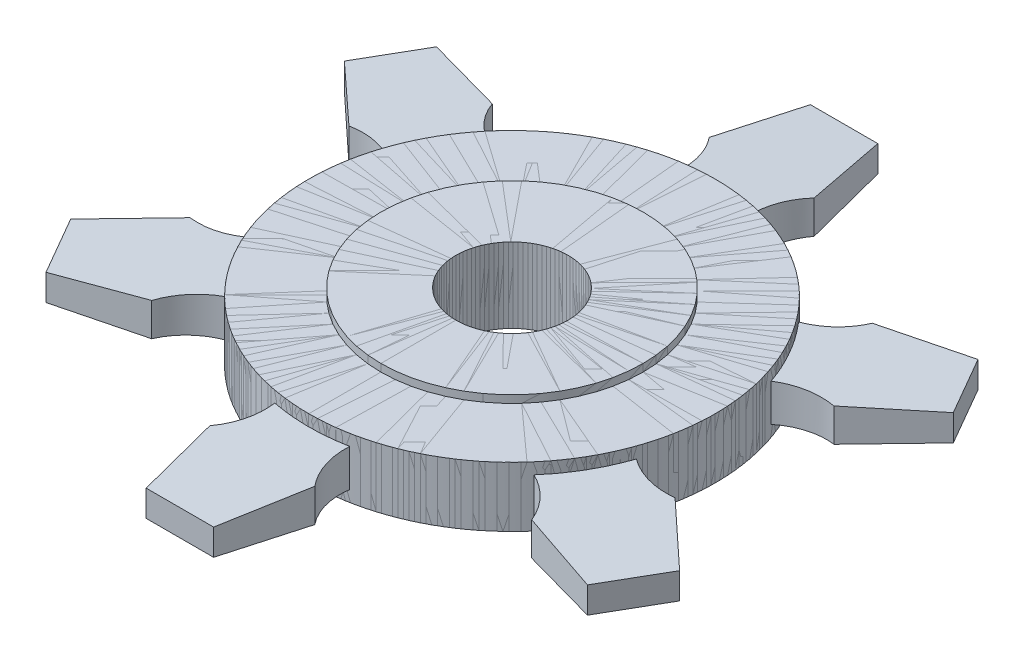
from build123d import *

# Parameters (mm, degrees)
EXTRUDE_2_DEPTH          = 2.5
SKETCH_4_OUTSIDE_W       = 24.277
SKETCH_4_OUTSIDE_H       = 11.616
CUT_EXTRUDE_1_DEPTH      = 10
SKETCH_1_7_R             = 17.5
EXTRUDE_3_DEPTH          = 4
SKETCH_1_8_R             = 17.5
SKETCH_1_8_R_2           = 7.5
EXTRUDE_4_DEPTH          = 5
PATTERN_CIRCULAR_3_COUNT = 6


with BuildPart() as part:
    # 草图1 → 凸台-拉伸2 (new, symmetric)
    with BuildSketch(Plane(origin=(0, 0, 0), x_dir=(1, 0, 0), z_dir=(0, 1, 0))):
        with BuildLine():
            Line((4.5, 44.320508076), (-4.5, 44.320508076))
            Line((-4.5, 44.320508076), (-7, 33.320508076))
            ThreePointArc((-7, 33.320508076), (-5.339644712, 30.188643407), (-5, 26.660188015))
            ThreePointArc((-5, 26.660188015), (0, 27.125), (5, 26.660188015))
            ThreePointArc((5, 26.660188015), (5.339644712, 30.188643407), (7, 33.320508076))
            Line((7, 33.320508076), (4.5, 44.320508076))
        make_face()
    extrude(amount=EXTRUDE_2_DEPTH, both=True)

    # 草图4 outside → 切除-拉伸1 (cut, symmetric)
    with BuildSketch(Plane(origin=(0, 0, 0), x_dir=(0, 0, -1), z_dir=(1, 0, 0))):
        with Locations((35.4905, 0)):
            Rectangle(SKETCH_4_OUTSIDE_W, SKETCH_4_OUTSIDE_H)
        Polygon((26.660188015, 2.5), (44.320508076, 1.75), (44.320508076, -1.75), (26.660188015, -2.5), align=None, mode=Mode.SUBTRACT)
    extrude(amount=CUT_EXTRUDE_1_DEPTH, both=True, mode=Mode.SUBTRACT)

    # 草图1<7> → 凸台-拉伸3 (add, symmetric)
    with BuildSketch(Plane(origin=(0, 0, 0), x_dir=(1, 0, 0), z_dir=(0, 1, 0))):
        with BuildLine():
            ThreePointArc((5, 26.660188015), (0, 27.125), (-5, 26.660188015))
            ThreePointArc((-5, 26.660188015), (-17.322537704, -20.8733158), (27.125, 0))
            ThreePointArc((27.125, 0), (20.8733158, 17.322537704), (5, 26.660188015))
        make_face()
        Circle(SKETCH_1_7_R, mode=Mode.SUBTRACT)
    extrude(amount=EXTRUDE_3_DEPTH, both=True)

    # 草图1<8> → 凸台-拉伸4 (add, symmetric)
    with BuildSketch(Plane(origin=(0, 0, 0), x_dir=(1, 0, 0), z_dir=(0, 1, 0))):
        Circle(SKETCH_1_8_R)
        Circle(SKETCH_1_8_R_2, mode=Mode.SUBTRACT)
    extrude(amount=EXTRUDE_4_DEPTH, both=True)


with BuildPart() as pattern_circular_3_1:
    # 阵列(圆周)3: pattern copy
    add(part.part.rotate(Axis((0, 5.5, 0), (0, -1, 0)), 1 * 360 / PATTERN_CIRCULAR_3_COUNT))


with BuildPart() as pattern_circular_3_2:
    # 阵列(圆周)3: pattern copy
    add(part.part.rotate(Axis((0, 5.5, 0), (0, -1, 0)), 2 * 360 / PATTERN_CIRCULAR_3_COUNT))


with BuildPart() as pattern_circular_3_3:
    # 阵列(圆周)3: pattern copy
    add(part.part.rotate(Axis((0, 5.5, 0), (0, -1, 0)), 3 * 360 / PATTERN_CIRCULAR_3_COUNT))


with BuildPart() as pattern_circular_3_4:
    # 阵列(圆周)3: pattern copy
    add(part.part.rotate(Axis((0, 5.5, 0), (0, -1, 0)), 4 * 360 / PATTERN_CIRCULAR_3_COUNT))


with BuildPart() as pattern_circular_3_5:
    # 阵列(圆周)3: pattern copy
    add(part.part.rotate(Axis((0, 5.5, 0), (0, -1, 0)), 5 * 360 / PATTERN_CIRCULAR_3_COUNT))


solid = Compound([part.part, pattern_circular_3_1.part, pattern_circular_3_2.part, pattern_circular_3_3.part, pattern_circular_3_4.part, pattern_circular_3_5.part])
